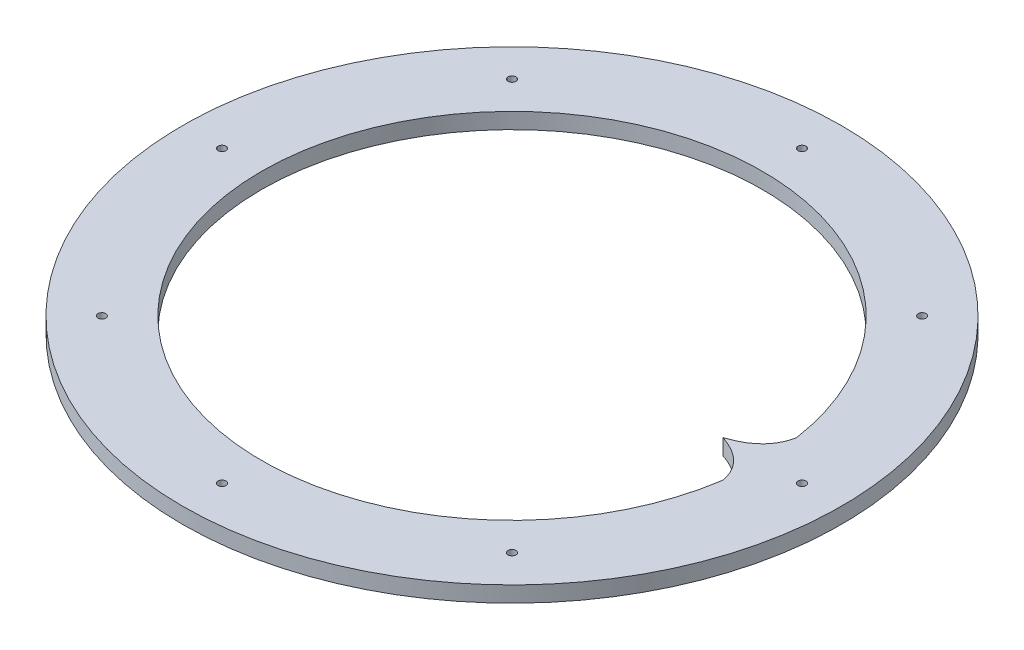
from build123d import *

# Parameters (mm, degrees)
SKETCH1_R           = 125
SKETCH1_R_2         = 1.5
BOSS_EXTRUDE1_DEPTH = 6


with BuildPart() as part:
    # Sketch1 → Boss-Extrude1 (new body)
    with BuildSketch(Plane(origin=(0, 0, 0), x_dir=(1, 0, 0), z_dir=(0, 1, 0))):
        Circle(SKETCH1_R)
        with Locations((0, -110)):
            Circle(SKETCH1_R_2, mode=Mode.SUBTRACT)
        with Locations((77.781745931, -77.781745931)):
            Circle(SKETCH1_R_2, mode=Mode.SUBTRACT)
        with Locations((110, 0)):
            Circle(SKETCH1_R_2, mode=Mode.SUBTRACT)
        with Locations((77.781745931, 77.781745931)):
            Circle(SKETCH1_R_2, mode=Mode.SUBTRACT)
        with Locations((0, 110)):
            Circle(SKETCH1_R_2, mode=Mode.SUBTRACT)
        with Locations((-77.781745931, 77.781745931)):
            Circle(SKETCH1_R_2, mode=Mode.SUBTRACT)
        with Locations((-110, 0)):
            Circle(SKETCH1_R_2, mode=Mode.SUBTRACT)
        with Locations((-77.781745931, -77.781745931)):
            Circle(SKETCH1_R_2, mode=Mode.SUBTRACT)
        with BuildLine():
            ThreePointArc((93.976500469, 13.907456977), (-95, 0), (93.976500469, -13.907456977))
            add(Edge.make_bspline(
                [(93.976500469, -13.907456977), (92.072801417, -3.957394346), (79.998651047, 0)],
                knots=[0, 0, 0, 1, 1, 1], degree=2))
            add(Edge.make_bspline(
                [(93.976500469, 13.907456977), (92.072801417, 3.957394346), (79.998651047, 0)],
                knots=[0, 0, 0, 1, 1, 1], degree=2))
        make_face(mode=Mode.SUBTRACT)
    extrude(amount=BOSS_EXTRUDE1_DEPTH)


solid = part.part
